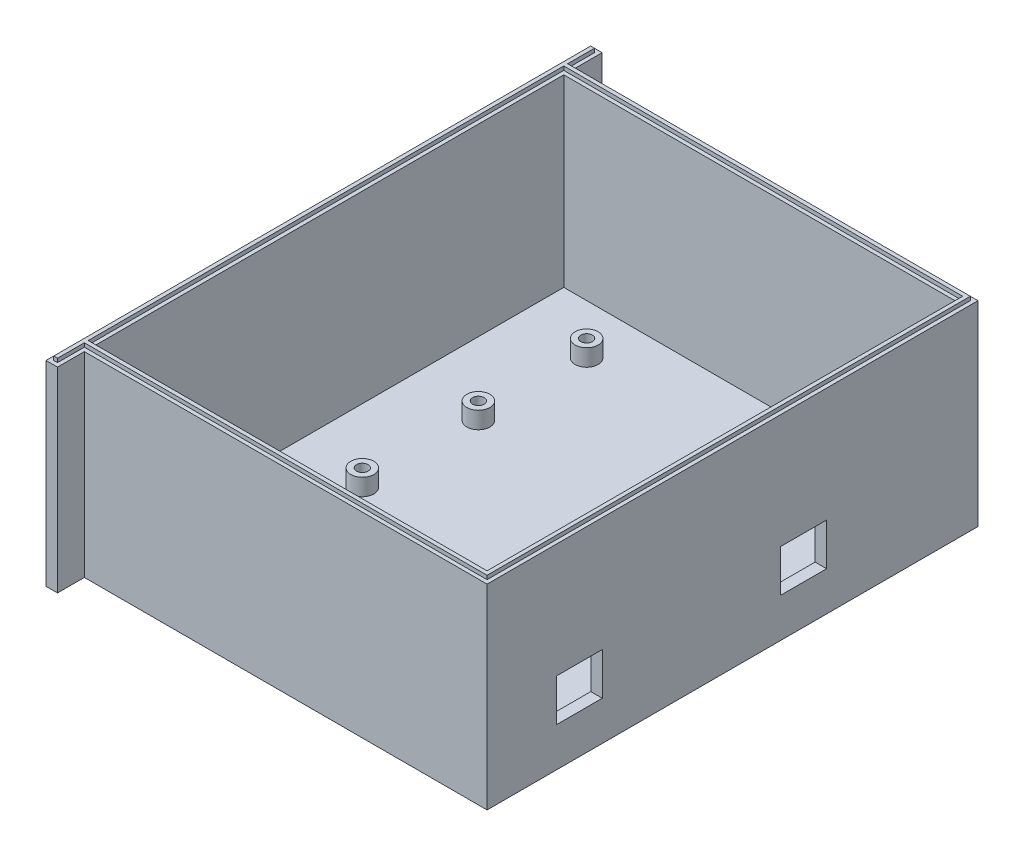
from build123d import *

# Parameters (mm, degrees)
BOSS_EXTRU_1_DEPTH      = 51
ESQUISSE2_W             = 102
ESQUISSE2_H             = 122
ENL_V_MAT_EXTRU_1_DEPTH = 48
ESQUISSE4_W             = 104
ESQUISSE4_H             = 124
BOSS_EXTRU_4_DEPTH      = 1
ESQUISSE5_R             = 3
ESQUISSE5_R_2           = 1.5
BOSS_EXTRU_5_DEPTH      = 4.41
ESQUISSE7_W             = 12
ESQUISSE7_H             = 11
ENL_V_MAT_EXTRU_2_DEPTH = 3


with BuildPart() as part:
    # Esquisse1 → Boss.-Extru.1 (new body)
    with BuildSketch(Plane(origin=(0, 0, 0), x_dir=(1, 0, 0), z_dir=(0, 1, 0))):
        Polygon((0, 0), (0, 142), (3, 142), (3, 135), (108, 135), (108, 7), (3, 7), (3, 0), align=None)
    extrude(amount=BOSS_EXTRU_1_DEPTH)

    # Esquisse2 → Enlèv. mat.-Extru.1 (cut)
    with BuildSketch(Plane(origin=(0, 51, 0), x_dir=(1, 0, 0), z_dir=(0, 1, 0))):
        with Locations((54, 71)):
            Rectangle(ESQUISSE2_W, ESQUISSE2_H)
    extrude(amount=-ENL_V_MAT_EXTRU_1_DEPTH, mode=Mode.SUBTRACT)

    # Esquisse4 → Boss.-Extru.4 (add)
    with BuildSketch(Plane(origin=(0, 51, 0), x_dir=(1, 0, 0), z_dir=(0, 1, 0))):
        Polygon((1, 1), (1, 141), (2, 141), (2, 134), (107, 134), (107, 8), (2, 8), (2, 1), align=None)
        with Locations((54, 71)):
            Rectangle(ESQUISSE4_W, ESQUISSE4_H, mode=Mode.SUBTRACT)
    extrude(amount=BOSS_EXTRU_4_DEPTH)

    # Esquisse5 → Boss.-Extru.5 (add)
    # profile 1 of 8: a face of its own
    with BuildSketch(Plane(origin=(0, 3, 0), x_dir=(1, 0, 0), z_dir=(0, 1, 0))):
        with Locations(Location((74.7, 124.56, 0), (0, 0, 270))):
            Circle(ESQUISSE5_R)
        with Locations(Location((74.7, 124.56, 0), (0, 0, 270))):
            Circle(ESQUISSE5_R_2, mode=Mode.SUBTRACT)
    # profile 2 of 8: a face of its own
    with BuildSketch(Plane(origin=(0, 3, 0), x_dir=(1, 0, 0), z_dir=(0, 1, 0))):
        with Locations(Location((73.7, 74.43, 0), (0, 0, 270))):
            Circle(ESQUISSE5_R)
        with Locations(Location((73.7, 74.43, 0), (0, 0, 270))):
            Circle(ESQUISSE5_R_2, mode=Mode.SUBTRACT)
    # profile 3 of 8: a face of its own
    with BuildSketch(Plane(origin=(0, 3, 0), x_dir=(1, 0, 0), z_dir=(0, 1, 0))):
        with Locations(Location((21.9, 32.346, 0), (0, 0, 270))):
            Circle(ESQUISSE5_R)
        with Locations(Location((21.9, 32.346, 0), (0, 0, 270))):
            Circle(ESQUISSE5_R_2, mode=Mode.SUBTRACT)
    # profile 4 of 8: a face of its own
    with BuildSketch(Plane(origin=(0, 3, 0), x_dir=(1, 0, 0), z_dir=(0, 1, 0))):
        with Locations(Location((73.7, 17.456, 0), (0, 0, 270))):
            Circle(ESQUISSE5_R)
        with Locations(Location((73.7, 17.456, 0), (0, 0, 270))):
            Circle(ESQUISSE5_R_2, mode=Mode.SUBTRACT)
    # profile 5 of 8: a face of its own
    with BuildSketch(Plane(origin=(0, 3, 0), x_dir=(1, 0, 0), z_dir=(0, 1, 0))):
        with Locations(Location((21.9, 60.576, 0), (0, 0, 270))):
            Circle(ESQUISSE5_R)
        with Locations(Location((21.9, 60.576, 0), (0, 0, 270))):
            Circle(ESQUISSE5_R_2, mode=Mode.SUBTRACT)
    # profile 6 of 8: a face of its own
    with BuildSketch(Plane(origin=(0, 3, 0), x_dir=(1, 0, 0), z_dir=(0, 1, 0))):
        with Locations(Location((21.9, 119.06, 0), (0, 0, 270))):
            Circle(ESQUISSE5_R)
        with Locations(Location((21.9, 119.06, 0), (0, 0, 270))):
            Circle(ESQUISSE5_R_2, mode=Mode.SUBTRACT)
    # profile 7 of 8: a face of its own
    with BuildSketch(Plane(origin=(0, 3, 0), x_dir=(1, 0, 0), z_dir=(0, 1, 0))):
        with Locations(Location((74.7, 66.086, 0), (0, 0, 270))):
            Circle(ESQUISSE5_R)
        with Locations(Location((74.7, 66.086, 0), (0, 0, 270))):
            Circle(ESQUISSE5_R_2, mode=Mode.SUBTRACT)
    # profile 8 of 8: a face of its own
    with BuildSketch(Plane(origin=(0, 3, 0), x_dir=(1, 0, 0), z_dir=(0, 1, 0))):
        with Locations(Location((21.9, 90.83, 0), (0, 0, 270))):
            Circle(ESQUISSE5_R)
        with Locations(Location((21.9, 90.83, 0), (0, 0, 270))):
            Circle(ESQUISSE5_R_2, mode=Mode.SUBTRACT)
    extrude(amount=BOSS_EXTRU_5_DEPTH)

    # Esquisse7 → Enlèv. mat.-Extru.2 (cut)
    with BuildSketch(Plane(origin=(108, 0, 0), x_dir=(0, 0, -1), z_dir=(1, 0, 0))):
        with Locations((31.04, 15.71)):
            Rectangle(ESQUISSE7_W, ESQUISSE7_H)
        with Locations((89.53, 15.71)):
            Rectangle(ESQUISSE7_W, ESQUISSE7_H)
    extrude(amount=-ENL_V_MAT_EXTRU_2_DEPTH, mode=Mode.SUBTRACT)


solid = part.part
